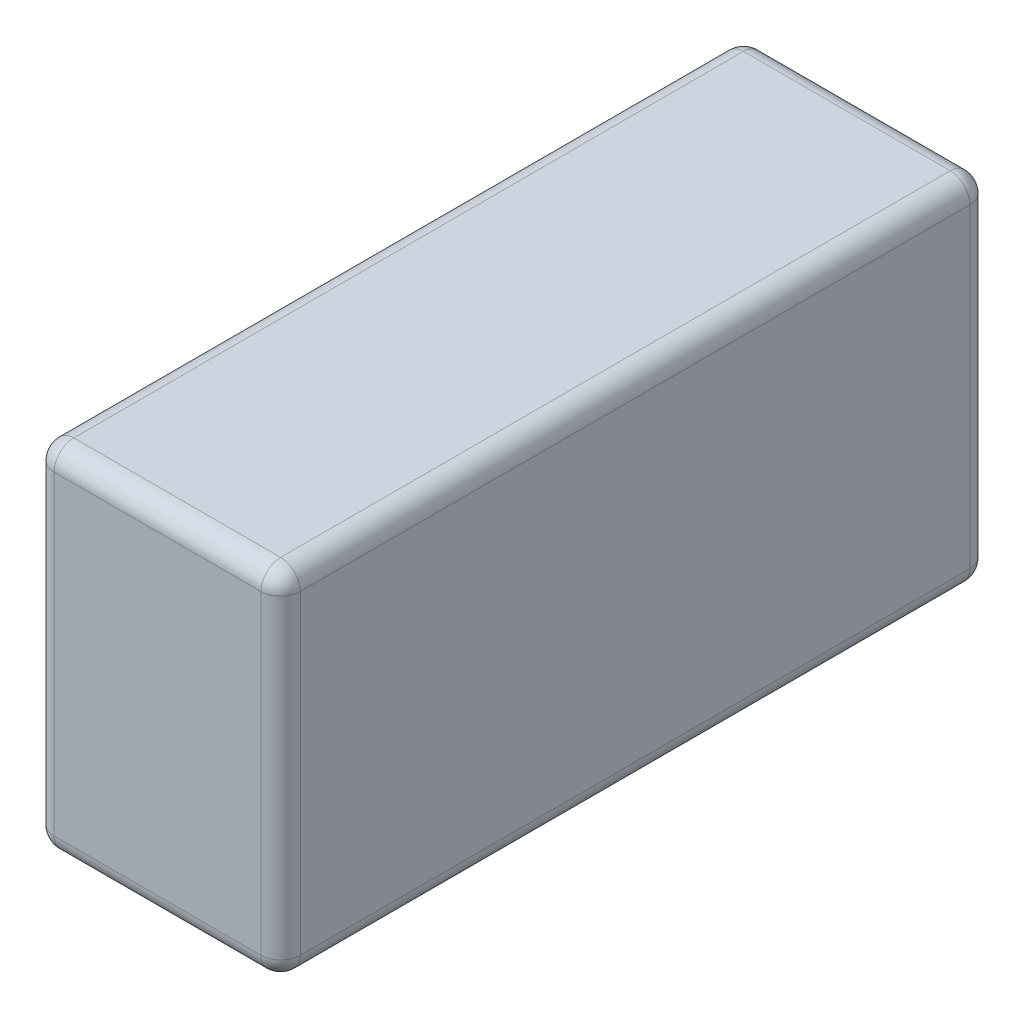
from build123d import *

# Parameters (mm, degrees)
CROQUIS1_W              = 25
CROQUIS1_H              = 36
SALIENTE_EXTRUIR1_DEPTH = 72
REDONDEO1_R             = 2


with BuildPart() as part:
    # Croquis1 → Saliente-Extruir1 (new body)
    with BuildSketch(Plane.XY):
        Rectangle(CROQUIS1_W, CROQUIS1_H)
    extrude(amount=SALIENTE_EXTRUIR1_DEPTH)

    # Redondeo1
    redondeo1_edges = [part.edges().sort_by_distance(p)[0] for p in [
        (-12.5, 0, 72),
        (0, -18, 72),
        (12.5, 0, 72),
        (0, -18, 0),
        (-12.5, 0, 0),
        (0, 18, 0),
        (12.5, 0, 0),
        (12.5, -18, 36),
        (-12.5, -18, 36),
        (-12.5, 18, 36),
        (12.5, 18, 36),
        (0, 18, 72),
    ]]
    fillet(redondeo1_edges, radius=REDONDEO1_R)


solid = part.part
